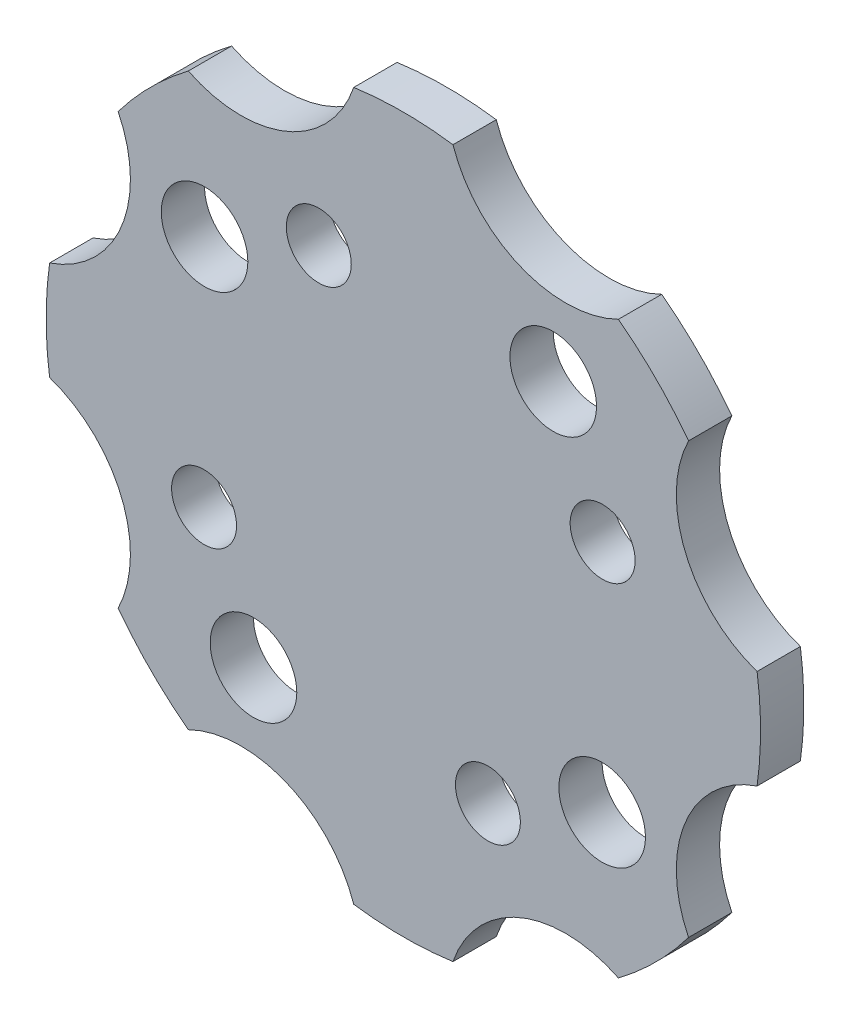
from build123d import *

# Parameters (mm, degrees)
BOSS_EXTRUDE1_DEPTH = 2
SKETCH2_R           = 1.5
SKETCH2_R_2         = 2
CUT_EXTRUDE1_DEPTH  = 24.420076857


with BuildPart() as part:
    # Sketch1 → Boss-Extrude1 (new body)
    with BuildSketch(Plane.XY):
        with BuildLine():
            ThreePointArc((2.29187449, 16.340052366), (0, 16.5), (-2.29187449, 16.340052366))
            ThreePointArc((-2.29187449, 16.340052366), (-5.395608595, 13.026151447), (-9.933561839, 13.174761826))
            ThreePointArc((-9.933561839, 13.174761826), (-11.66726189, 11.66726189), (-13.174761826, 9.933561839))
            ThreePointArc((-13.174761826, 9.933561839), (-13.026151447, 5.395608595), (-16.340052366, 2.29187449))
            ThreePointArc((-16.340052366, 2.29187449), (-16.5, 0), (-16.340052366, -2.29187449))
            ThreePointArc((-16.340052366, -2.29187449), (-13.026151447, -5.395608595), (-13.174761826, -9.933561839))
            ThreePointArc((-13.174761826, -9.933561839), (-11.66726189, -11.66726189), (-9.933561839, -13.174761826))
            ThreePointArc((-9.933561839, -13.174761826), (-5.395608595, -13.026151447), (-2.29187449, -16.340052366))
            ThreePointArc((-2.29187449, -16.340052366), (0, -16.5), (2.29187449, -16.340052366))
            ThreePointArc((2.29187449, -16.340052366), (5.395608595, -13.026151447), (9.933561839, -13.174761826))
            ThreePointArc((9.933561839, -13.174761826), (11.66726189, -11.66726189), (13.174761826, -9.933561839))
            ThreePointArc((13.174761826, -9.933561839), (13.026151447, -5.395608595), (16.340052366, -2.29187449))
            ThreePointArc((16.340052366, -2.29187449), (16.5, 0), (16.340052366, 2.29187449))
            ThreePointArc((16.340052366, 2.29187449), (13.026151447, 5.395608595), (13.174761826, 9.933561839))
            ThreePointArc((13.174761826, 9.933561839), (11.66726189, 11.66726189), (9.933561839, 13.174761826))
            ThreePointArc((9.933561839, 13.174761826), (5.395608595, 13.026151447), (2.29187449, 16.340052366))
        make_face()
    extrude(amount=BOSS_EXTRUDE1_DEPTH)

    # Sketch2 → Cut-Extrude1 (cut, through all)
    with BuildSketch(Plane.XY.offset(2)):
        with Locations((9.205631104, 3.905938552)):
            Circle(SKETCH2_R)
        with Locations((6.922242286, 9.183276198)):
            Circle(SKETCH2_R_2)
        with Locations((9.183276198, -6.922242286)):
            Circle(SKETCH2_R_2)
        with Locations((3.905938552, -9.205631104)):
            Circle(SKETCH2_R)
        with Locations((-6.922242286, -9.183276198)):
            Circle(SKETCH2_R_2)
        with Locations((-9.205631104, -3.905938552)):
            Circle(SKETCH2_R)
        with Locations((-9.183276198, 6.922242286)):
            Circle(SKETCH2_R_2)
        with Locations((-3.905938552, 9.205631104)):
            Circle(SKETCH2_R)
    extrude(amount=-CUT_EXTRUDE1_DEPTH, mode=Mode.SUBTRACT)


solid = part.part
